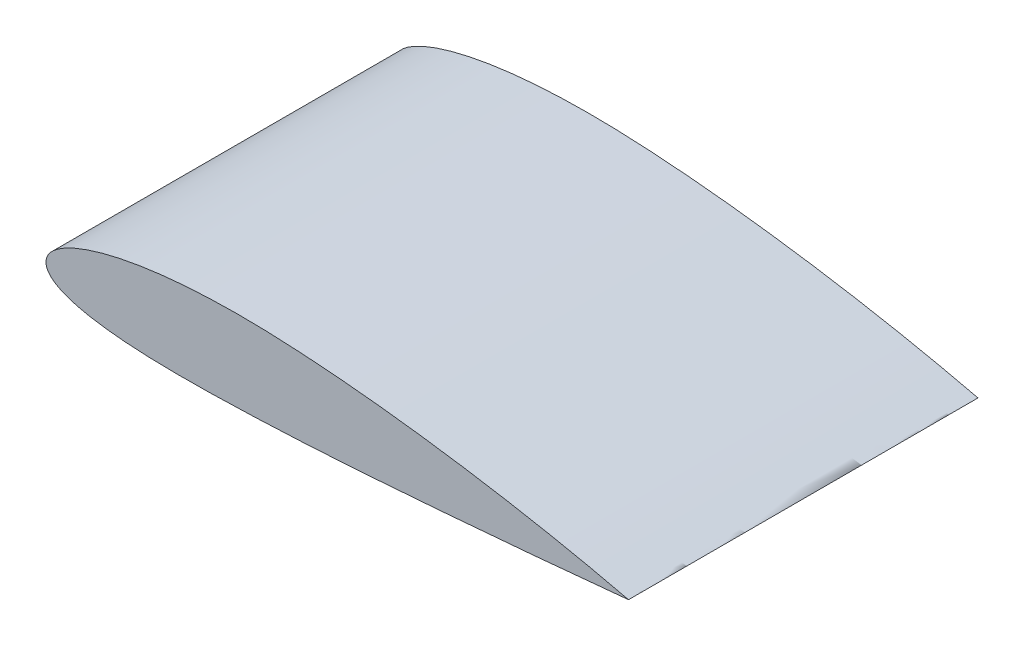
from build123d import *

# Parameters (mm, degrees)
BOSS_EXTRUDE1_DEPTH = 90


with BuildPart() as part:
    # Sketch1 → Boss-Extrude1 (new body)
    with BuildSketch(Plane(origin=(0, 0, 0), x_dir=(0, 1, 0), z_dir=(0, 0, 1))):
        with BuildLine():
            add(Edge.make_bspline(
                [(0, -150), (0.002071972, -150.000128592), (0.015676267, -149.921286381), (0.040047195, -149.840618534), (0.084618666, -149.641362995), (0.144576153, -149.393057547), (0.222816135, -149.062063466), (0.316997243, -148.662478931), (0.428301766, -148.189654995), (0.555312572, -147.645740064), (0.698487644, -147.030715545), (0.856787959, -146.345188073), (1.029910381, -145.589777167), (1.217714594, -144.765273715), (1.419402366, -143.872413979), (1.634239067, -142.911920266), (1.861907908, -141.884816233), (2.101436866, -140.791958891), (2.352709676, -139.634475666), (2.614452377, -138.413280737), (2.886325978, -137.129613155), (3.167434122, -135.784670535), (3.457353369, -134.379770639), (3.754960464, -132.916136064), (4.059683758, -131.395163864), (4.370603029, -129.818310411), (4.687353423, -128.18710135), (5.008866774, -126.503082815), (5.33412795, -124.767807152), (5.66315451, -122.983084741), (5.994076096, -121.15045021), (6.327012864, -119.271772565), (6.661014138, -117.348862249), (6.99488814, -115.383452885), (7.328248885, -113.377515945), (7.660260837, -111.333035335), (7.989968759, -109.251928889), (8.316915635, -107.136350406), (8.64001782, -104.988240728), (8.958882244, -102.809810879), (9.27240468, -100.603051394), (9.580145585, -98.370263901), (9.881146136, -96.113568015), (10.174590307, -93.835206582), (10.459990494, -91.537406711), (10.736527983, -89.222452859), (11.003549654, -86.892710939), (11.259927202, -84.550433774), (11.505502813, -82.198030883), (11.739267847, -79.83775899), (11.960974522, -77.472019318), (12.16896049, -75.103116252), (12.363855673, -72.733570488), (12.543961904, -70.365633341), (12.709103574, -68.001747229), (12.858918506, -65.644320807), (12.992456853, -63.295780013), (13.109534862, -60.954159846), (13.209137877, -58.618820134), (13.285407104, -56.291962062), (13.339148869, -53.980409314), (13.369549199, -51.689494806), (13.376592947, -49.421675211), (13.360149509, -47.179346187), (13.319875216, -44.965015709), (13.256371281, -42.780921966), (13.16934647, -40.62946537), (13.058566706, -38.512923906), (12.925143698, -36.433594897), (12.768527774, -34.393738088), (12.589810122, -32.395439512), (12.388724082, -30.440965443), (12.166285882, -28.532263661), (11.922938652, -26.671384728), (11.658889306, -24.860345467), (11.375483965, -23.101002771), (11.073230709, -21.395231254), (10.752580924, -19.744790388), (10.414762684, -18.151310012), (10.060719124, -16.616465426), (9.690917168, -15.14185827), (9.306725311, -13.728937023), (8.90910926, -12.379023162), (8.49853491, -11.093651837), (8.076948065, -9.873733766), (7.64438841, -8.72072521), (7.202760888, -7.635431664), (6.75219437, -6.61915182), (6.294246038, -5.672564287), (5.8298026, -4.796427925), (5.359395934, -3.991738289), (4.884338649, -3.258865999), (4.405208697, -2.598557877), (3.922621573, -2.011234396), (3.437358218, -1.497268834), (2.949853364, -1.056960707), (2.46051134, -0.690746495), (1.969594448, -0.398832448), (1.477132343, -0.18237672), (0.983811868, -0.040934893), (0.489948469, 0.023929762), (-0.001244859, 0.012337077), (-0.484950952, -0.073518147), (-0.95608464, -0.234733942), (-1.412008172, -0.469478915), (-1.852136087, -0.777444415), (-2.276679313, -1.157160271), (-2.685847514, -1.607882245), (-3.079686469, -2.129030104), (-3.458330605, -2.719932424), (-3.821593497, -3.379983674), (-4.169554685, -4.108425152), (-4.502100917, -4.904445548), (-4.819263097, -5.767247475), (-5.120278143, -6.696040012), (-5.405868281, -7.689629218), (-5.675359462, -8.747139729), (-5.928676053, -9.867457181), (-6.165878868, -11.049376722), (-6.386984631, -12.29170647), (-6.591792463, -13.593282331), (-6.779986526, -14.952800071), (-6.952219573, -16.368834408), (-7.108162193, -17.840055394), (-7.248197313, -19.365081338), (-7.372088702, -20.942400919), (-7.480393024, -22.57053449), (-7.572965593, -24.247963439), (-7.650590738, -25.973111276), (-7.713042736, -27.744357508), (-7.761330713, -29.560078914), (-7.795201631, -31.418697357), (-7.815548355, -33.318451415), (-7.822656358, -35.257597246), (-7.817181323, -37.234383471), (-7.799806426, -39.247064039), (-7.770725746, -41.293833556), (-7.731178213, -43.372851725), (-7.681407535, -45.482214702), (-7.621886153, -47.620063508), (-7.554065891, -49.784421086), (-7.477998829, -51.973417719), (-7.39464519, -54.185012831), (-7.304688278, -56.417253227), (-7.208742276, -58.670988339), (-7.108390498, -60.948523722), (-6.998888703, -63.247391872), (-6.880852966, -65.56250019), (-6.754586302, -67.887291678), (-6.621084709, -70.219589716), (-6.480704823, -72.557124833), (-6.334565631, -74.89763256), (-6.182442687, -77.23885785), (-6.025804067, -79.578513463), (-5.864466528, -81.91434461), (-5.699436233, -84.244081439), (-5.531432443, -86.565491577), (-5.360116722, -88.876209613), (-5.187041241, -91.174071019), (-5.011724121, -93.456744658), (-4.835448193, -95.722101761), (-4.658035939, -97.967794366), (-4.479907307, -100.191672992), (-4.302074633, -102.391491556), (-4.123885795, -104.565060555), (-3.94675072, -106.710274753), (-3.770267884, -108.824922825), (-3.594690302, -110.906949924), (-3.42101788, -112.954265446), (-3.248825921, -114.96485812), (-3.078639087, -116.936655367), (-2.910690251, -118.867701526), (-2.74526841, -120.755995548), (-2.582785149, -122.599706205), (-2.423081719, -124.396901891), (-2.26651192, -126.145795975), (-2.113444577, -127.844599253), (-1.963934586, -129.491544134), (-1.818342117, -131.085045119), (-1.676801831, -132.623341716), (-1.539581033, -134.104990031), (-1.40695271, -135.528347058), (-1.278770449, -136.892025442), (-1.155995582, -138.194601718), (-1.037801417, -139.434669206), (-0.925523422, -140.611045436), (-0.818285118, -141.722413038), (-0.717376632, -142.767686553), (-0.622074412, -143.745721836), (-0.533077635, -144.655477518), (-0.45023092, -145.496062069), (-0.374107807, -146.266518413), (-0.304634114, -146.96609941), (-0.242194549, -147.594047694), (-0.186467259, -148.14956441), (-0.138120417, -148.632674253), (-0.09680686, -149.04099419), (-0.063082714, -149.379329374), (-0.03619403, -149.63332754), (-0.01848483, -149.836717003), (-0.005040516, -149.919884405), (-0.002075674, -149.999871178), (0, -150)],
                knots=[0, 0, 0, 0, 0.000122162, 0.000488762, 0.001098626, 0.001952115, 0.003047447, 0.004384646, 0.005961345, 0.007776149, 0.009827055, 0.012112674, 0.014630312, 0.017376908, 0.020350611, 0.023547571, 0.026965104, 0.030599371, 0.034446745, 0.038503772, 0.042766258, 0.047229438, 0.05188913, 0.056740961, 0.061779713, 0.067000652, 0.072398192, 0.077967523, 0.08370241, 0.08959738, 0.095646999, 0.101844368, 0.108184337, 0.114660164, 0.121265364, 0.127993862, 0.134838073, 0.141792018, 0.148848139, 0.155999995, 0.163240053, 0.170561898, 0.177957061, 0.185419088, 0.192940636, 0.20051383, 0.208131297, 0.215785146, 0.223468149, 0.231172508, 0.238890976, 0.246615713, 0.254338679, 0.262052579, 0.269750303, 0.277423306, 0.285064463, 0.292666233, 0.300263366, 0.307835405, 0.315345957, 0.322787926, 0.330154754, 0.337438456, 0.344632551, 0.351729593, 0.35872415, 0.365608397, 0.372376389, 0.379021837, 0.385538356, 0.391920689, 0.398161978, 0.40425792, 0.410202821, 0.415990749, 0.421617467, 0.427078334, 0.432368972, 0.437485147, 0.442422347, 0.447178292, 0.451748435, 0.456130522, 0.460322332, 0.464321065, 0.468125969, 0.471735326, 0.475149045, 0.478367901, 0.481393138, 0.484226536, 0.486872777, 0.48933663, 0.49162681, 0.493752608, 0.495728375, 0.497571482, 0.499304595, 0.500954468, 0.502554253, 0.504138225, 0.505722331, 0.50732137, 0.508970882, 0.510701621, 0.512540316, 0.51450828, 0.516622701, 0.518896628, 0.521339375, 0.523957653, 0.526757322, 0.529740579, 0.532910336, 0.536266754, 0.539810217, 0.543540238, 0.547455024, 0.551552863, 0.555832131, 0.560290011, 0.564922705, 0.569728018, 0.574702205, 0.579841337, 0.585140965, 0.590597949, 0.596207167, 0.60196384, 0.60786366, 0.613901712, 0.620073053, 0.626371698, 0.63279258, 0.639330581, 0.645979571, 0.652733843, 0.659587676, 0.666534338, 0.673568484, 0.680682851, 0.687872069, 0.695128803, 0.702446649, 0.709847519, 0.717337734, 0.72486724, 0.732430232, 0.740018868, 0.74762532, 0.755243172, 0.762864145, 0.770481283, 0.778086776, 0.785673683, 0.793234113, 0.800760763, 0.808246147, 0.815682957, 0.823063732, 0.830381646, 0.837628336, 0.844797828, 0.851881875, 0.858873971, 0.865767325, 0.872554094, 0.879228778, 0.885783616, 0.892212703, 0.898509164, 0.90466661, 0.910678649, 0.916539946, 0.922243626, 0.927784267, 0.933156491, 0.938353905, 0.943372588, 0.94820566, 0.952849684, 0.957298797, 0.961548983, 0.96559544, 0.969434107, 0.973061153, 0.976472512, 0.979664354, 0.982634162, 0.985377526, 0.987892897, 0.99017635, 0.992226383, 0.994040087, 0.995616398, 0.996952891, 0.998048065, 0.998901385, 0.999511398, 0.999877619, 1, 1, 1, 1], degree=3))
        make_face()
    extrude(amount=BOSS_EXTRUDE1_DEPTH)


solid = part.part
